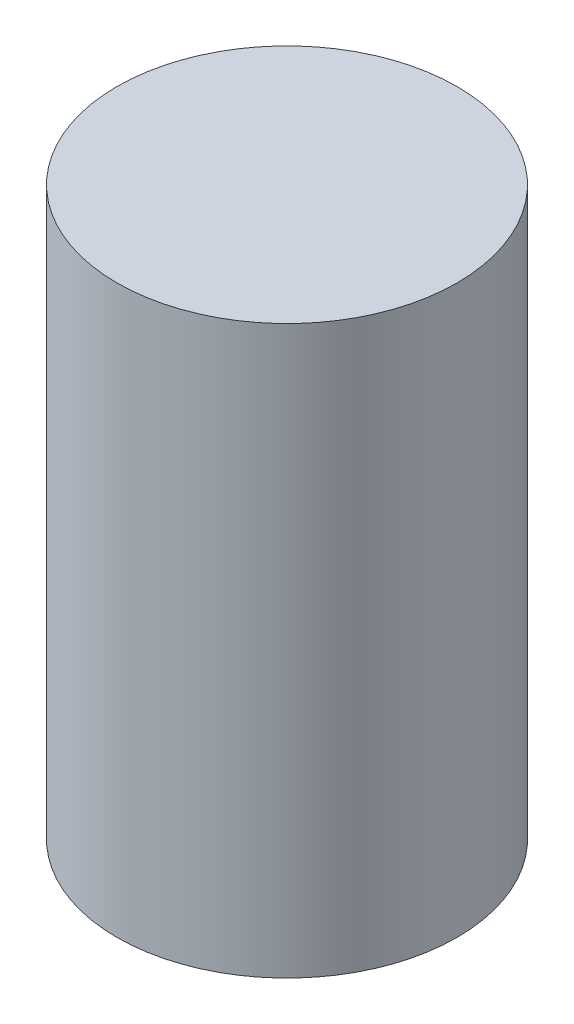
from build123d import *

# Parameters (mm, degrees)
SKETCH1_R           = 0.9
BOSS_EXTRUDE1_DEPTH = 3


with BuildPart() as part:
    # Sketch1 → Boss-Extrude1 (new body)
    with BuildSketch(Plane(origin=(0, 0, 0), x_dir=(1, 0, 0), z_dir=(0, 1, 0))):
        with Locations(Location((0, 0, 0), (0, 0, 270))):
            Circle(SKETCH1_R)
    extrude(amount=BOSS_EXTRUDE1_DEPTH)


solid = part.part
